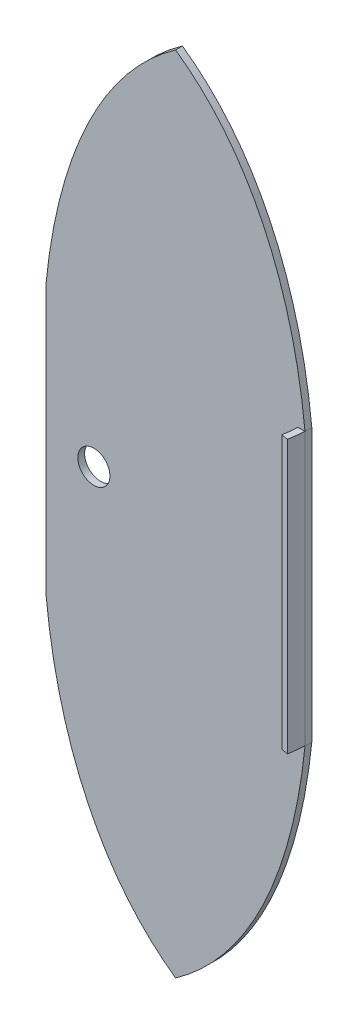
from build123d import *

# Parameters (mm, degrees)
SKETCH1_R           = 5.9944
BOSS_EXTRUDE1_DEPTH = 2.54
SKETCH1_5_W         = 2.54
SKETCH1_5_H         = 101.6
REVOLVE3_ANGLE      = 10


with BuildPart() as part:
    # Sketch1 → Boss-Extrude1 (new body)
    with BuildSketch(Plane.XY):
        with BuildLine():
            add(Edge.make_bspline(
                [(-48.26, 0), (-44.589659251, 36.55139004), (-31.409290844, 76.960823803), (0, 99.06)],
                knots=[0, 0, 0, 0, 1, 1, 1, 1], degree=3))
            Line((-48.26, 0), (-48.26, -101.6))
            add(Edge.make_bspline(
                [(-48.26, -101.6), (-44.589659251, -138.15139004), (-31.409290844, -178.560823803), (0, -200.66)],
                knots=[0, 0, 0, 0, 1, 1, 1, 1], degree=3))
            add(Edge.make_bspline(
                [(48.26, -101.6), (44.589659251, -138.15139004), (31.409290844, -178.560823803), (0, -200.66)],
                knots=[0, 0, 0, 0, 1, 1, 1, 1], degree=3))
            Line((48.26, -101.6), (48.26, 0))
            add(Edge.make_bspline(
                [(48.26, 0), (44.589659251, 36.55139004), (31.409290844, 76.960823803), (0, 99.06)],
                knots=[0, 0, 0, 0, 1, 1, 1, 1], degree=3))
        make_face()
        with Locations((-30.48, -50.8)):
            Circle(SKETCH1_R, mode=Mode.SUBTRACT)
    extrude(amount=BOSS_EXTRUDE1_DEPTH)

    # Sketch1<5> → Revolve3 (revolve)
    with BuildSketch(Plane.XY):
        with Locations((46.99, -50.8)):
            Rectangle(SKETCH1_5_W, SKETCH1_5_H)
    revolve(axis=Axis((0, 0, 0), (0, -1, 0)), revolution_arc=REVOLVE3_ANGLE)


solid = part.part
